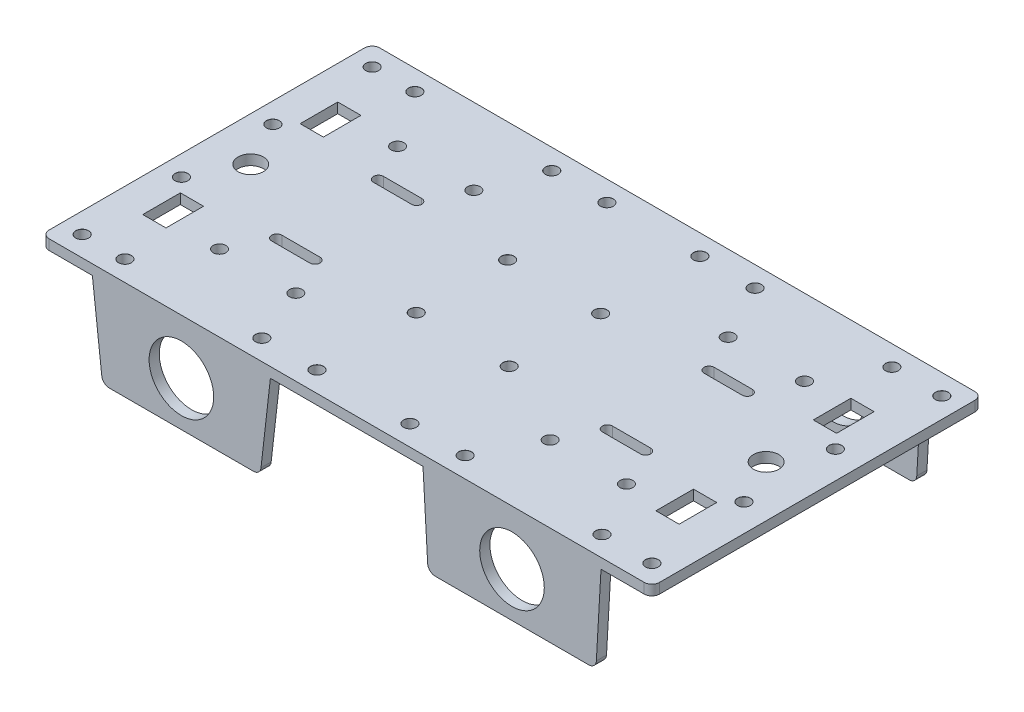
from build123d import *

# Parameters (mm, degrees)
SKETCH_2_W                      = 240
SKETCH_2_H                      = 130
EXTRUDE_1_DEPTH                 = 4
FILLET_1_R                      = 3
SKETCH_4_W                      = 70
SKETCH_4_H                      = 4
EXTRUDE_3_DEPTH                 = 35
CUT_EXTRUDE_1_DEPTH             = 181.346887969
CUT_EXTRUDE_1_DEPTH_BACK        = 181.346887969
CUT_EXTRUDE_2_DEPTH             = 181.346887969
CUT_EXTRUDE_2_DEPTH_BACK        = 181.346887969
FILLET_2_R                      = 3
FILLET_3_R                      = 3
CUT_EXTRUDE_3_DEPTH             = 181.346887969
CUT_EXTRUDE_3_DEPTH_BACK        = 181.346887969
SKETCH_10_R                     = 12.7
CUT_EXTRUDE_4_REACH             = 143.937
SKETCH_11_R                     = 2.5
CUT_EXTRUDE_4_DIRECTION_2_DEPTH = 142.936605567
HOLE_WIZARD_5_0_5_4_D           = 5
HOLE_WIZARD_5_0_5_4_CSINK_D     = 5.05
HOLE_WIZARD_5_0_5_4_CSINK_ANGLE = 90
HOLE_WIZARD_5_0_5_5_D           = 5
HOLE_WIZARD_5_0_5_5_CSINK_D     = 5.05
HOLE_WIZARD_5_0_5_5_CSINK_ANGLE = 90
SKETCH_26_W                     = 9.130018581
SKETCH_26_H                     = 14.776214284
CUT_EXTRUDE_5_DEPTH             = 10
SKETCH_22_R                     = 5
CUT_EXTRUDE_6_DEPTH             = 10


with BuildPart() as part:
    # 草图2 → 凸台-拉伸1 (new body)
    with BuildSketch(Plane(origin=(0, 0, 0), x_dir=(1, 0, 0), z_dir=(0, 1, 0))):
        Rectangle(SKETCH_2_W, SKETCH_2_H)
    extrude(amount=EXTRUDE_1_DEPTH)

    # 圆角1
    fillet_1_edges = [part.edges().sort_by_distance(p)[0] for p in [
        (120, 2, 65),
        (-120, 2, 65),
        (-120, 2, -65),
        (120, 2, -65),
    ]]
    fillet(fillet_1_edges, radius=FILLET_1_R)

    # 草图4 → 凸台-拉伸3 (add)
    with BuildSketch(Plane.XZ):
        with Locations((65, 63)):
            Rectangle(SKETCH_4_W, SKETCH_4_H)
        with Locations((-65, 63)):
            Rectangle(SKETCH_4_W, SKETCH_4_H)
        with Locations((65, -63)):
            Rectangle(SKETCH_4_W, SKETCH_4_H)
        with Locations((-65, -63)):
            Rectangle(SKETCH_4_W, SKETCH_4_H)
    extrude(amount=EXTRUDE_3_DEPTH)

    # 草图7 → 切除-拉伸1 (cut, two sides: drawn at the far end of the back side and taken through both)
    with BuildSketch(Plane.XY.offset(65).offset(-CUT_EXTRUDE_1_DEPTH_BACK)):
        Polygon((-100, 0), (-96, -35), (-100, -35), align=None)
        Polygon((-30, 0), (-34, -35), (-30, -35), align=None)
    extrude(amount=CUT_EXTRUDE_1_DEPTH + CUT_EXTRUDE_1_DEPTH_BACK, mode=Mode.SUBTRACT)

    # 草图9 → 切除-拉伸2 (cut, two sides: drawn at the far end of the back side and taken through both)
    with BuildSketch(Plane.XY.offset(65).offset(-CUT_EXTRUDE_2_DEPTH_BACK)):
        Polygon((30, 0), (32, -35), (30, -35), align=None)
        Polygon((98, -35), (100, -35), (100, 0), align=None)
    extrude(amount=CUT_EXTRUDE_2_DEPTH + CUT_EXTRUDE_2_DEPTH_BACK, mode=Mode.SUBTRACT)

    # 圆角2
    fillet_2_edges = [part.edges().sort_by_distance(p)[0] for p in [
        (-96, -35, 63),
    ]]
    fillet(fillet_2_edges, radius=FILLET_2_R)

    # 圆角3
    fillet_3_edges = [part.edges().sort_by_distance(p)[0] for p in [
        (98, -35, -63),
        (32, -35, -63),
        (98, -35, 63),
        (32, -35, 63),
        (-34, -35, -63),
        (-96, -35, -63),
        (-34, -35, 63),
    ]]
    fillet(fillet_3_edges, radius=FILLET_3_R)

    # 草图10 → 切除-拉伸3 (cut, two sides: drawn at the far end of the back side and taken through both)
    with BuildSketch(Plane.XY.offset(65).offset(-CUT_EXTRUDE_3_DEPTH_BACK)):
        with Locations((-65, -17.5)):
            Circle(SKETCH_10_R)
        with Locations(Location((65, -17.5, 0), (0, 0, 180))):
            Circle(SKETCH_10_R)
    extrude(amount=CUT_EXTRUDE_3_DEPTH + CUT_EXTRUDE_3_DEPTH_BACK, mode=Mode.SUBTRACT)

    # 草图11 → 切除-拉伸4 (cut, up to next)
    with BuildSketch(Plane(origin=(0, 4, 0), x_dir=(1, 0, 0), z_dir=(0, 1, 0)), mode=Mode.PRIVATE) as cut_extrude_4_sk1:
        with Locations(Location((-80, -35, 0), (0, 0, 90))):
            Circle(SKETCH_11_R)
    cut_extrude_4_tool1 = extrude(cut_extrude_4_sk1.sketch, amount=-CUT_EXTRUDE_4_REACH, mode=Mode.PRIVATE) & part.part
    # 草图11 → 切除-拉伸4 (cut, up to next)
    with BuildSketch(Plane(origin=(0, 4, 0), x_dir=(1, 0, 0), z_dir=(0, 1, 0)), mode=Mode.PRIVATE) as cut_extrude_4_sk2:
        with Locations(Location((-50, -35, 0), (0, 0, 90))):
            Circle(SKETCH_11_R)
    cut_extrude_4_tool2 = extrude(cut_extrude_4_sk2.sketch, amount=-CUT_EXTRUDE_4_REACH, mode=Mode.PRIVATE) & part.part
    # 草图11 → 切除-拉伸4 (cut, up to next)
    with BuildSketch(Plane(origin=(0, 4, 0), x_dir=(1, 0, 0), z_dir=(0, 1, 0)), mode=Mode.PRIVATE) as cut_extrude_4_sk3:
        with Locations(Location((-50, 35, 0), (0, 0, 90))):
            Circle(SKETCH_11_R)
    cut_extrude_4_tool3 = extrude(cut_extrude_4_sk3.sketch, amount=-CUT_EXTRUDE_4_REACH, mode=Mode.PRIVATE) & part.part
    # 草图11 → 切除-拉伸4 (cut, up to next)
    with BuildSketch(Plane(origin=(0, 4, 0), x_dir=(1, 0, 0), z_dir=(0, 1, 0)), mode=Mode.PRIVATE) as cut_extrude_4_sk4:
        with Locations(Location((-80, 35, 0), (0, 0, 90))):
            Circle(SKETCH_11_R)
    cut_extrude_4_tool4 = extrude(cut_extrude_4_sk4.sketch, amount=-CUT_EXTRUDE_4_REACH, mode=Mode.PRIVATE) & part.part
    # 草图11 → 切除-拉伸4 (cut, up to next)
    with BuildSketch(Plane(origin=(0, 4, 0), x_dir=(1, 0, 0), z_dir=(0, 1, 0)), mode=Mode.PRIVATE) as cut_extrude_4_sk5:
        with Locations(Location((50, -35, 0), (0, 0, 90))):
            Circle(SKETCH_11_R)
    cut_extrude_4_tool5 = extrude(cut_extrude_4_sk5.sketch, amount=-CUT_EXTRUDE_4_REACH, mode=Mode.PRIVATE) & part.part
    # 草图11 → 切除-拉伸4 (cut, up to next)
    with BuildSketch(Plane(origin=(0, 4, 0), x_dir=(1, 0, 0), z_dir=(0, 1, 0)), mode=Mode.PRIVATE) as cut_extrude_4_sk6:
        with Locations(Location((50, 35, 0), (0, 0, 90))):
            Circle(SKETCH_11_R)
    cut_extrude_4_tool6 = extrude(cut_extrude_4_sk6.sketch, amount=-CUT_EXTRUDE_4_REACH, mode=Mode.PRIVATE) & part.part
    # 草图11 → 切除-拉伸4 (cut, up to next)
    with BuildSketch(Plane(origin=(0, 4, 0), x_dir=(1, 0, 0), z_dir=(0, 1, 0)), mode=Mode.PRIVATE) as cut_extrude_4_sk7:
        with Locations(Location((80, -35, 0), (0, 0, 90))):
            Circle(SKETCH_11_R)
    cut_extrude_4_tool7 = extrude(cut_extrude_4_sk7.sketch, amount=-CUT_EXTRUDE_4_REACH, mode=Mode.PRIVATE) & part.part
    # 草图11 → 切除-拉伸4 (cut, up to next)
    with BuildSketch(Plane(origin=(0, 4, 0), x_dir=(1, 0, 0), z_dir=(0, 1, 0)), mode=Mode.PRIVATE) as cut_extrude_4_sk8:
        with Locations(Location((80, 35, 0), (0, 0, 90))):
            Circle(SKETCH_11_R)
    cut_extrude_4_tool8 = extrude(cut_extrude_4_sk8.sketch, amount=-CUT_EXTRUDE_4_REACH, mode=Mode.PRIVATE) & part.part
    # 草图11 → 切除-拉伸4 (cut, up to next)
    with BuildSketch(Plane(origin=(0, 4, 0), x_dir=(1, 0, 0), z_dir=(0, 1, 0)), mode=Mode.PRIVATE) as cut_extrude_4_sk9:
        with BuildLine():
            Line((-72.5, -18), (-57.5, -18))
            ThreePointArc((-57.5, -18), (-55.5, -20), (-57.5, -22))
            Line((-57.5, -22), (-72.5, -22))
            ThreePointArc((-72.5, -22), (-74.5, -20), (-72.5, -18))
        make_face()
    cut_extrude_4_tool9 = extrude(cut_extrude_4_sk9.sketch, amount=-CUT_EXTRUDE_4_REACH, mode=Mode.PRIVATE) & part.part
    # 草图11 → 切除-拉伸4 (cut, up to next)
    with BuildSketch(Plane(origin=(0, 4, 0), x_dir=(1, 0, 0), z_dir=(0, 1, 0)), mode=Mode.PRIVATE) as cut_extrude_4_sk10:
        with BuildLine():
            Line((-72.5, 18), (-57.5, 18))
            ThreePointArc((-57.5, 18), (-55.5, 20), (-57.5, 22))
            Line((-57.5, 22), (-72.5, 22))
            ThreePointArc((-72.5, 22), (-74.5, 20), (-72.5, 18))
        make_face()
    cut_extrude_4_tool10 = extrude(cut_extrude_4_sk10.sketch, amount=-CUT_EXTRUDE_4_REACH, mode=Mode.PRIVATE) & part.part
    # 草图11 → 切除-拉伸4 (cut, up to next)
    with BuildSketch(Plane(origin=(0, 4, 0), x_dir=(1, 0, 0), z_dir=(0, 1, 0)), mode=Mode.PRIVATE) as cut_extrude_4_sk11:
        with BuildLine():
            Line((72.5, -18), (57.5, -18))
            ThreePointArc((57.5, -18), (55.5, -20), (57.5, -22))
            Line((57.5, -22), (72.5, -22))
            ThreePointArc((72.5, -22), (74.5, -20), (72.5, -18))
        make_face()
    cut_extrude_4_tool11 = extrude(cut_extrude_4_sk11.sketch, amount=-CUT_EXTRUDE_4_REACH, mode=Mode.PRIVATE) & part.part
    # 草图11 → 切除-拉伸4 (cut, up to next)
    with BuildSketch(Plane(origin=(0, 4, 0), x_dir=(1, 0, 0), z_dir=(0, 1, 0)), mode=Mode.PRIVATE) as cut_extrude_4_sk12:
        with BuildLine():
            Line((72.5, 18), (57.5, 18))
            ThreePointArc((57.5, 18), (55.5, 20), (57.5, 22))
            Line((57.5, 22), (72.5, 22))
            ThreePointArc((72.5, 22), (74.5, 20), (72.5, 18))
        make_face()
    cut_extrude_4_tool12 = extrude(cut_extrude_4_sk12.sketch, amount=-CUT_EXTRUDE_4_REACH, mode=Mode.PRIVATE) & part.part
    add(cut_extrude_4_tool1.solids().sort_by_distance((-80, 4, 35))[0], mode=Mode.SUBTRACT)
    add(cut_extrude_4_tool2.solids().sort_by_distance((-50, 4, 35))[0], mode=Mode.SUBTRACT)
    add(cut_extrude_4_tool3.solids().sort_by_distance((-50, 4, -35))[0], mode=Mode.SUBTRACT)
    add(cut_extrude_4_tool4.solids().sort_by_distance((-80, 4, -35))[0], mode=Mode.SUBTRACT)
    add(cut_extrude_4_tool5.solids().sort_by_distance((50, 4, 35))[0], mode=Mode.SUBTRACT)
    add(cut_extrude_4_tool6.solids().sort_by_distance((50, 4, -35))[0], mode=Mode.SUBTRACT)
    add(cut_extrude_4_tool7.solids().sort_by_distance((80, 4, 35))[0], mode=Mode.SUBTRACT)
    add(cut_extrude_4_tool8.solids().sort_by_distance((80, 4, -35))[0], mode=Mode.SUBTRACT)
    add(cut_extrude_4_tool9.solids().sort_by_distance((-65, 4, 20))[0], mode=Mode.SUBTRACT)
    add(cut_extrude_4_tool10.solids().sort_by_distance((-65, 4, -20))[0], mode=Mode.SUBTRACT)
    add(cut_extrude_4_tool11.solids().sort_by_distance((65, 4, 20))[0], mode=Mode.SUBTRACT)
    add(cut_extrude_4_tool12.solids().sort_by_distance((65, 4, -20))[0], mode=Mode.SUBTRACT)

    # 草图11 → 切除-拉伸4 direction 2 (cut)
    with BuildSketch(Plane(origin=(0, 4, 0), x_dir=(1, 0, 0), z_dir=(0, 1, 0))):
        with Locations(Location((-80, -35, 0), (0, 0, 90))):
            Circle(SKETCH_11_R)
        with Locations(Location((-50, -35, 0), (0, 0, 90))):
            Circle(SKETCH_11_R)
        with Locations(Location((-50, 35, 0), (0, 0, 90))):
            Circle(SKETCH_11_R)
        with Locations(Location((-80, 35, 0), (0, 0, 90))):
            Circle(SKETCH_11_R)
        with Locations(Location((50, -35, 0), (0, 0, 90))):
            Circle(SKETCH_11_R)
        with Locations(Location((50, 35, 0), (0, 0, 90))):
            Circle(SKETCH_11_R)
        with Locations(Location((80, -35, 0), (0, 0, 90))):
            Circle(SKETCH_11_R)
        with Locations(Location((80, 35, 0), (0, 0, 90))):
            Circle(SKETCH_11_R)
        with BuildLine():
            Line((-72.5, -18), (-57.5, -18))
            ThreePointArc((-57.5, -18), (-55.5, -20), (-57.5, -22))
            Line((-57.5, -22), (-72.5, -22))
            ThreePointArc((-72.5, -22), (-74.5, -20), (-72.5, -18))
        make_face()
        with BuildLine():
            Line((-72.5, 18), (-57.5, 18))
            ThreePointArc((-57.5, 18), (-55.5, 20), (-57.5, 22))
            Line((-57.5, 22), (-72.5, 22))
            ThreePointArc((-72.5, 22), (-74.5, 20), (-72.5, 18))
        make_face()
        with BuildLine():
            Line((72.5, -18), (57.5, -18))
            ThreePointArc((57.5, -18), (55.5, -20), (57.5, -22))
            Line((57.5, -22), (72.5, -22))
            ThreePointArc((72.5, -22), (74.5, -20), (72.5, -18))
        make_face()
        with BuildLine():
            Line((72.5, 18), (57.5, 18))
            ThreePointArc((57.5, 18), (55.5, 20), (57.5, 22))
            Line((57.5, 22), (72.5, 22))
            ThreePointArc((72.5, 22), (74.5, 20), (72.5, 18))
        make_face()
    extrude(amount=CUT_EXTRUDE_4_DIRECTION_2_DEPTH, mode=Mode.SUBTRACT)

    # Ø5.0 (5) 直径孔4 (through all)
    with Locations(Plane(origin=(0, 4, 0), x_dir=(1, 0, 0), z_dir=(0, 1, 0))):
        with Locations((-112, 57), (-112, -57), (112, -57), (112, 57)):
            CounterSinkHole(HOLE_WIZARD_5_0_5_4_D / 2, HOLE_WIZARD_5_0_5_4_CSINK_D / 2, counter_sink_angle=HOLE_WIZARD_5_0_5_4_CSINK_ANGLE)

    # Ø5.0 (5) 直径孔5 (through all)
    with Locations(Plane(origin=(0, 4, 0), x_dir=(1, 0, 0), z_dir=(0, 1, 0))):
        with Locations((-95.192123364, 57), (-41.370416483, 57), (-19.681071919, 57), (-19.681071919, 17.973880171), (-112, 17.973880171), (-112, -17.973880171), (-95.192123364, -57), (-41.370416483, -57), (-19.681071919, -57), (-19.681071919, -17.973880171), (16.869490216, 17.973880171), (16.869490216, -17.973880171), (16.869490216, 57), (38.55883478, 57), (92.380541661, 57), (109.188418297, 17.973880171), (109.188418297, -17.973880171), (92.380541661, -57), (38.55883478, -57), (16.869490216, -57)):
            CounterSinkHole(HOLE_WIZARD_5_0_5_5_D / 2, HOLE_WIZARD_5_0_5_5_CSINK_D / 2, counter_sink_angle=HOLE_WIZARD_5_0_5_5_CSINK_ANGLE)

    # 草图26 → 切除-拉伸5 (cut)
    with BuildSketch(Plane(origin=(0, 4, 0), x_dir=(1, 0, 0), z_dir=(0, 1, 0))):
        with Locations((-102.29021779, 30.941404151)):
            Rectangle(SKETCH_26_W, SKETCH_26_H)
        with Locations((-102.29021779, -30.941404151)):
            Rectangle(SKETCH_26_W, SKETCH_26_H)
        with Locations((99.478636087, -30.941404151)):
            Rectangle(SKETCH_26_W, SKETCH_26_H)
        with Locations((99.478636087, 30.941404151)):
            Rectangle(SKETCH_26_W, SKETCH_26_H)
    extrude(amount=-CUT_EXTRUDE_5_DEPTH, mode=Mode.SUBTRACT)

    # 草图22 → 切除-拉伸6 (cut)
    with BuildSketch(Plane(origin=(0, 4, 0), x_dir=(1, 0, 0), z_dir=(0, 1, 0))):
        with Locations(Location((-102.73836527, 0, 0), (0, 0, 270))):
            Circle(SKETCH_22_R)
        with Locations(Location((99.926783567, 0, 0), (0, 0, 90))):
            Circle(SKETCH_22_R)
    extrude(amount=-CUT_EXTRUDE_6_DEPTH, mode=Mode.SUBTRACT)


solid = part.part
